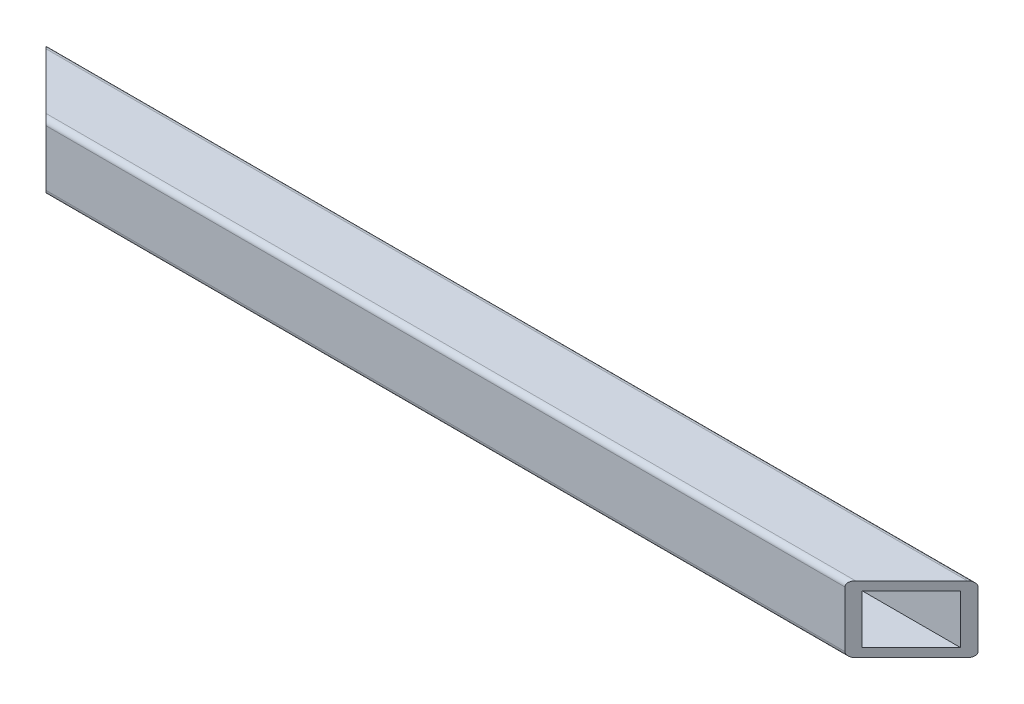
from build123d import *

# Parameters (mm, degrees)
SKETCH1_W           = 23.495
SKETCH1_H           = 23.495
BOSS_EXTRUDE1_DEPTH = 177.8
SCALE1_SCALE_X      = 1
SCALE1_SCALE_Y      = 0.4
SCALE1_SCALE_Z      = 0.4
CUT_EXTRUDE3_REACH  = 181.633


with BuildPart() as part:
    # Sketch1 → Boss-Extrude1 (new body)
    with BuildSketch(Plane(origin=(0, 0, 0), x_dir=(0, 0, -1), z_dir=(1, 0, 0))):
        with BuildLine():
            Line((0, 2.54), (0, 29.21))
            ThreePointArc((0, 29.21), (-0.743948776, 31.006051224), (-2.54, 31.75))
            Line((-2.54, 31.75), (-29.21, 31.75))
            ThreePointArc((-29.21, 31.75), (-31.006051224, 31.006051224), (-31.75, 29.21))
            Line((-31.75, 29.21), (-31.75, 2.54))
            ThreePointArc((-31.75, 2.54), (-31.006051224, 0.743948776), (-29.21, 0))
            Line((-29.21, 0), (-2.54, 0))
            ThreePointArc((-2.54, 0), (-0.743948776, 0.743948776), (0, 2.54))
        make_face()
        with Locations((-15.875, 15.875)):
            Rectangle(SKETCH1_W, SKETCH1_H, mode=Mode.SUBTRACT)
    extrude(amount=BOSS_EXTRUDE1_DEPTH)


with BuildPart() as part_1:
    # Scale1: scaled about (88.9, 15.875, 15.875)
    add(part.part.scale((SCALE1_SCALE_X, SCALE1_SCALE_Y, SCALE1_SCALE_Z), about=(88.9, 15.875, 15.875)))

    # Sketch3 → Cut-Extrude3 (cut, up to next)
    with BuildSketch(Plane(origin=(0, 22.225, 0), x_dir=(1, 0, 0), z_dir=(0, 1, 0)), mode=Mode.PRIVATE) as cut_extrude3_sk1:
        Polygon((0, -9.525), (0, -22.225), (12.7, -22.225), align=None)
    cut_extrude3_tool1 = extrude(cut_extrude3_sk1.sketch, amount=-CUT_EXTRUDE3_REACH, mode=Mode.PRIVATE) & part_1.part
    # Sketch3 → Cut-Extrude3 (cut, up to next)
    with BuildSketch(Plane(origin=(0, 22.225, 0), x_dir=(1, 0, 0), z_dir=(0, 1, 0)), mode=Mode.PRIVATE) as cut_extrude3_sk2:
        Polygon((177.8, -22.225), (165.1, -22.225), (177.8, -9.525), align=None)
    cut_extrude3_tool2 = extrude(cut_extrude3_sk2.sketch, amount=-CUT_EXTRUDE3_REACH, mode=Mode.PRIVATE) & part_1.part
    add(cut_extrude3_tool1.solids().sort_by_distance((4.233333, 22.225, 17.991667))[0], mode=Mode.SUBTRACT)
    add(cut_extrude3_tool2.solids().sort_by_distance((173.566667, 22.225, 17.991667))[0], mode=Mode.SUBTRACT)


solid = part_1.part
